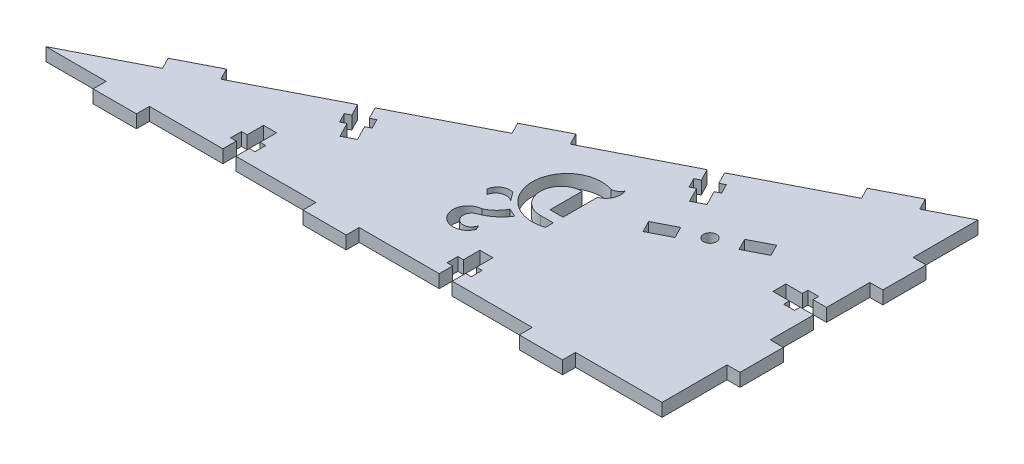
from build123d import *

# Parameters (mm, degrees)
SKETCH1_R           = 1.5
BOSS_EXTRUDE1_DEPTH = 3


with BuildPart() as part:
    # Sketch1 → Boss-Extrude1 (new body)
    with BuildSketch(Plane(origin=(0, 0, 0), x_dir=(1, 0, 0), z_dir=(0, 1, 0))):
        Polygon((0, 73), (-8.898516379, 68.4375), (-10.267266379, 71.107054914), (-19.165782758, 66.544554914), (-17.797032758, 63.875), (-38.708546249, 53.153125), (-37.294171249, 50.394584922), (-36.13736412, 50.987709922), (-34.99673912, 48.763080828), (-36.153546249, 48.169955828), (-34.419796249, 44.788519604), (-37.089351163, 43.419769604), (-38.823101163, 46.801205828), (-39.979908292, 46.208080828), (-41.120533292, 48.432709922), (-39.963726163, 49.025834922), (-41.378101163, 51.784375), (-62.289614654, 41.0625), (-63.658364654, 43.732054914), (-72.556881033, 39.169554914), (-71.188131033, 36.5), (-92.099644524, 25.778125), (-90.685269524, 23.019584922), (-89.528462395, 23.612709922), (-88.387837395, 21.388080828), (-89.544644524, 20.794955828), (-87.810894524, 17.413519604), (-90.480449438, 16.044769604), (-92.214199438, 19.426205828), (-93.371006567, 18.833080828), (-94.511631567, 21.057709922), (-93.354824438, 21.650834922), (-94.769199438, 24.409375), (-115.680712929, 13.6875), (-117.049462929, 16.357054914), (-125.947979308, 11.794554914), (-124.579229308, 9.125), (-142.376262066, 0), (-128.476262066, 0), (-128.476262066, -3), (-118.476262066, -3), (-118.476262066, 0), (-101.5, 0), (-101.5, 3.1), (-102.8, 3.1), (-102.8, 5.6), (-101.5, 5.6), (-101.5, 9.4), (-98.5, 9.4), (-98.5, 5.6), (-97.2, 5.6), (-97.2, 3.1), (-98.5, 3.1), (-98.5, 0), (-80, 0), (-80, -3), (-70, -3), (-70, 0), (-51.5, 0), (-51.5, 3.1), (-52.8, 3.1), (-52.8, 5.6), (-51.5, 5.6), (-51.5, 9.4), (-48.5, 9.4), (-48.5, 5.6), (-47.2, 5.6), (-47.2, 3.1), (-48.5, 3.1), (-48.5, 0), (-30, 0), (-30, -3), (-20, -3), (-20, 0), (0, 0), (0, 15), (3, 15), (3, 25), (0, 25), (0, 35), (-3.1, 35), (-3.1, 33.7), (-5.6, 33.7), (-5.6, 35), (-9.4, 35), (-9.4, 38), (-5.6, 38), (-5.6, 39.3), (-3.1, 39.3), (-3.1, 38), (0, 38), (0, 48), (3, 48), (3, 58), (0, 58), align=None)
        with Locations(Location((-27.355510267, 38.424597543, 0), (0, 0, 270))):
            Circle(SKETCH1_R, mode=Mode.SUBTRACT)
        Polygon((-18.2, 44.675), (-23.094184009, 42.165625), (-21.725434009, 39.496070086), (-16.83125, 42.005445086), align=None, mode=Mode.SUBTRACT)
        Polygon((-32.858434402, 37.159240731), (-31.489684402, 34.489685817), (-36.383868411, 31.980310817), (-37.752618411, 34.649865731), align=None, mode=Mode.SUBTRACT)
        with BuildLine():
            Line((-48.5, 33.56496631), (-48.5, 25.598461138))
            Line((-48.5, 25.598461138), (-51.491944896, 25.598461138))
            Line((-51.491944896, 25.598461138), (-51.491944896, 32.995360227))
            ThreePointArc((-51.491944896, 32.995360227), (-56.315394441, 28.171910682), (-51.491944896, 23.348461138))
            Line((-51.491944896, 23.348461138), (-48.5, 23.348461138))
            Line((-48.5, 23.348461138), (-48.5, 21.548461138))
            ThreePointArc((-48.5, 21.548461138), (-59.151745227, 29.1370418), (-48.5, 36.725622462))
            ThreePointArc((-48.5, 36.725622462), (-47.33660311, 37.110417568), (-46.55, 38.05))
            ThreePointArc((-46.55, 38.05), (-46.596119109, 35.403624932), (-48.5, 33.56496631))
        make_face(mode=Mode.SUBTRACT)
        with BuildLine():
            Line((-62.945288743, 22.499922927), (-61.814756339, 21.369390522))
            ThreePointArc((-61.814756339, 21.369390522), (-60.26196681, 23.207262023), (-57.875304833, 22.902677745))
            Line((-57.875304833, 22.902677745), (-59.34866377, 24.848461138))
            ThreePointArc((-59.34866377, 24.848461138), (-61.658382233, 24.457375162), (-62.945288743, 22.499922927))
        make_face(mode=Mode.SUBTRACT)
        with BuildLine():
            Line((-56.219305992, 21.108017954), (-54.281025882, 20.251876901))
            ThreePointArc((-54.281025882, 20.251876901), (-56.459608889, 17.845467185), (-59.295560451, 16.26609694))
            ThreePointArc((-59.295560451, 16.26609694), (-59.670500049, 12.923855807), (-56.562556798, 14.209096735))
            Line((-56.562556798, 14.209096735), (-56.075146683, 13.110422752))
            ThreePointArc((-56.075146683, 13.110422752), (-62.116171263, 12.397132702), (-59.571948462, 17.922500654))
            ThreePointArc((-59.571948462, 17.922500654), (-57.634172668, 19.240087777), (-56.219305992, 21.108017954))
        make_face(mode=Mode.SUBTRACT)
    extrude(amount=BOSS_EXTRUDE1_DEPTH)


solid = part.part
